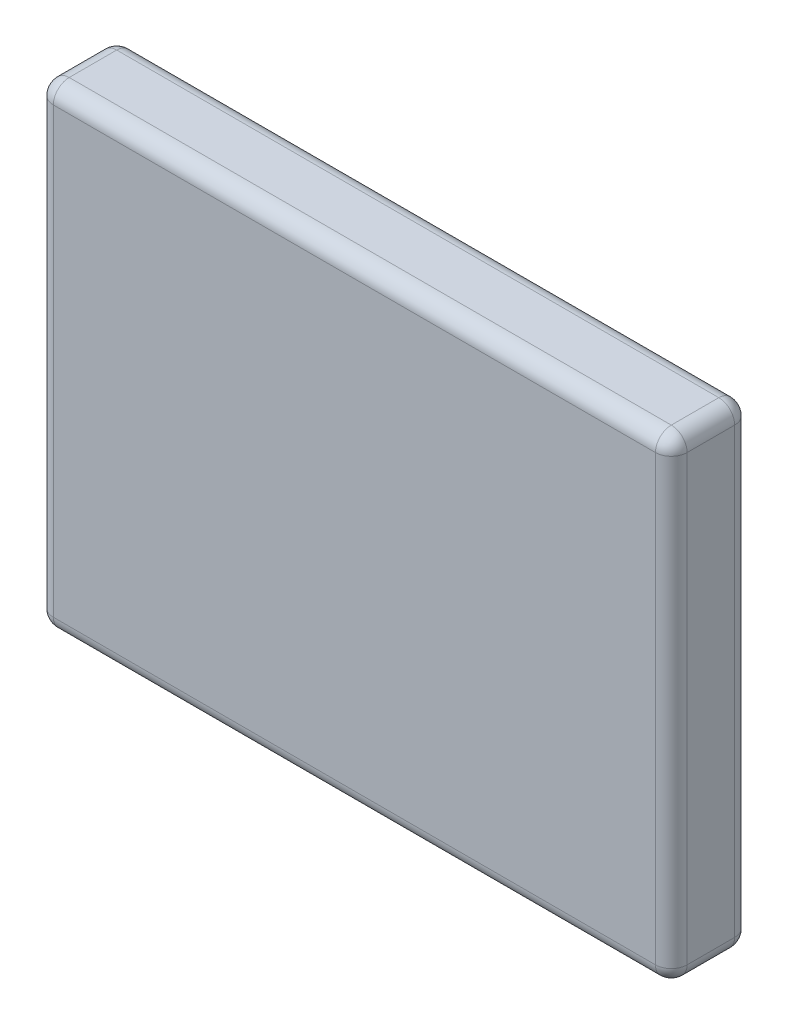
from build123d import *

# Parameters (mm, degrees)
SKETCH1_W           = 101.6
SKETCH1_H           = 76.2
BOSS_EXTRUDE1_DEPTH = 12.7
FILLET1_R           = 2.54


with BuildPart() as part:
    # Sketch1 → Boss-Extrude1 (new body)
    with BuildSketch(Plane.XY):
        with Locations((50.8, 38.1)):
            Rectangle(SKETCH1_W, SKETCH1_H)
    extrude(amount=BOSS_EXTRUDE1_DEPTH)

    # Fillet1
    fillet1_edges = [part.edges().sort_by_distance(p)[0] for p in [
        (101.6, 38.1, 12.7),
        (50.8, 76.2, 12.7),
        (0, 38.1, 12.7),
        (50.8, 76.2, 0),
        (101.6, 38.1, 0),
        (50.8, 0, 0),
        (0, 38.1, 0),
        (0, 76.2, 6.35),
        (101.6, 76.2, 6.35),
        (101.6, 0, 6.35),
        (0, 0, 6.35),
        (50.8, 0, 12.7),
    ]]
    fillet(fillet1_edges, radius=FILLET1_R)


solid = part.part
